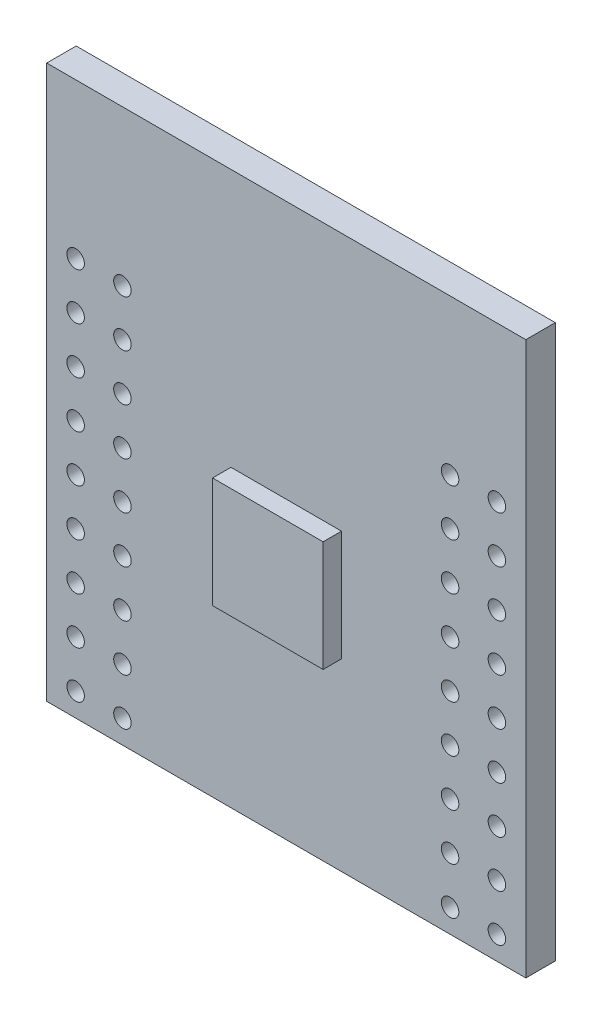
from build123d import *

# Parameters (mm, degrees)
SKETCH_1_W             = 26
SKETCH_1_H             = 30
EXTRUDE_1_DEPTH        = 1.6
SKETCH_2_W             = 6
SKETCH_2_H             = 6
EXTRUDE_2_DEPTH        = 1
CUT_EXTRUDE_1_REACH    = 21.914
SKETCH_3_R             = 0.475
PATTERN_LINEAR_2_COUNT = 9
PATTERN_LINEAR_2_PITCH = 2.54


with BuildPart() as part:
    # 草图1 → 凸台-拉伸1 (new body)
    with BuildSketch(Plane.XY):
        Rectangle(SKETCH_1_W, SKETCH_1_H)
    extrude(amount=-EXTRUDE_1_DEPTH)

    # 草图2 → 凸台-拉伸2 (add)
    with BuildSketch(Plane.XY):
        with Locations((0, -2)):
            Rectangle(SKETCH_2_W, SKETCH_2_H)
    extrude(amount=EXTRUDE_2_DEPTH)

    # 草图3 → 切除-拉伸1 (cut, up to next)
    with BuildSketch(Plane.XY, mode=Mode.PRIVATE) as cut_extrude_1_sk1:
        with Locations((-11.43, -13.73)):
            Circle(SKETCH_3_R)
    cut_extrude_1_tool1 = extrude(cut_extrude_1_sk1.sketch, amount=-CUT_EXTRUDE_1_REACH, mode=Mode.PRIVATE) & part.part
    # 草图3 → 切除-拉伸1 (cut, up to next)
    with BuildSketch(Plane.XY, mode=Mode.PRIVATE) as cut_extrude_1_sk2:
        with Locations((11.43, -13.73)):
            Circle(SKETCH_3_R)
    cut_extrude_1_tool2 = extrude(cut_extrude_1_sk2.sketch, amount=-CUT_EXTRUDE_1_REACH, mode=Mode.PRIVATE) & part.part
    # 草图3 → 切除-拉伸1 (cut, up to next)
    with BuildSketch(Plane.XY, mode=Mode.PRIVATE) as cut_extrude_1_sk3:
        with Locations((-8.89, -13.73)):
            Circle(SKETCH_3_R)
    cut_extrude_1_tool3 = extrude(cut_extrude_1_sk3.sketch, amount=-CUT_EXTRUDE_1_REACH, mode=Mode.PRIVATE) & part.part
    # 草图3 → 切除-拉伸1 (cut, up to next)
    with BuildSketch(Plane.XY, mode=Mode.PRIVATE) as cut_extrude_1_sk4:
        with Locations((8.89, -13.73)):
            Circle(SKETCH_3_R)
    cut_extrude_1_tool4 = extrude(cut_extrude_1_sk4.sketch, amount=-CUT_EXTRUDE_1_REACH, mode=Mode.PRIVATE) & part.part
    cut_extrude_1_1 = cut_extrude_1_tool1.solids().sort_by_distance((-11.43, -13.73, 0))[0]
    add(cut_extrude_1_1, mode=Mode.SUBTRACT)
    cut_extrude_1_2 = cut_extrude_1_tool2.solids().sort_by_distance((11.43, -13.73, 0))[0]
    add(cut_extrude_1_2, mode=Mode.SUBTRACT)
    cut_extrude_1_3 = cut_extrude_1_tool3.solids().sort_by_distance((-8.89, -13.73, 0))[0]
    add(cut_extrude_1_3, mode=Mode.SUBTRACT)
    cut_extrude_1_4 = cut_extrude_1_tool4.solids().sort_by_distance((8.89, -13.73, 0))[0]
    add(cut_extrude_1_4, mode=Mode.SUBTRACT)
    cut_extrude_1 = cut_extrude_1_1 + cut_extrude_1_2 + cut_extrude_1_3 + cut_extrude_1_4  # 切除-拉伸1 as one shape, for the pattern or mirror that repeats it

    # 阵列(线性)2: 切除-拉伸1 ×9
    with Locations(*[(0, i * PATTERN_LINEAR_2_PITCH, 0) for i in range(1, PATTERN_LINEAR_2_COUNT)]):
        add(cut_extrude_1, mode=Mode.SUBTRACT)


solid = part.part
